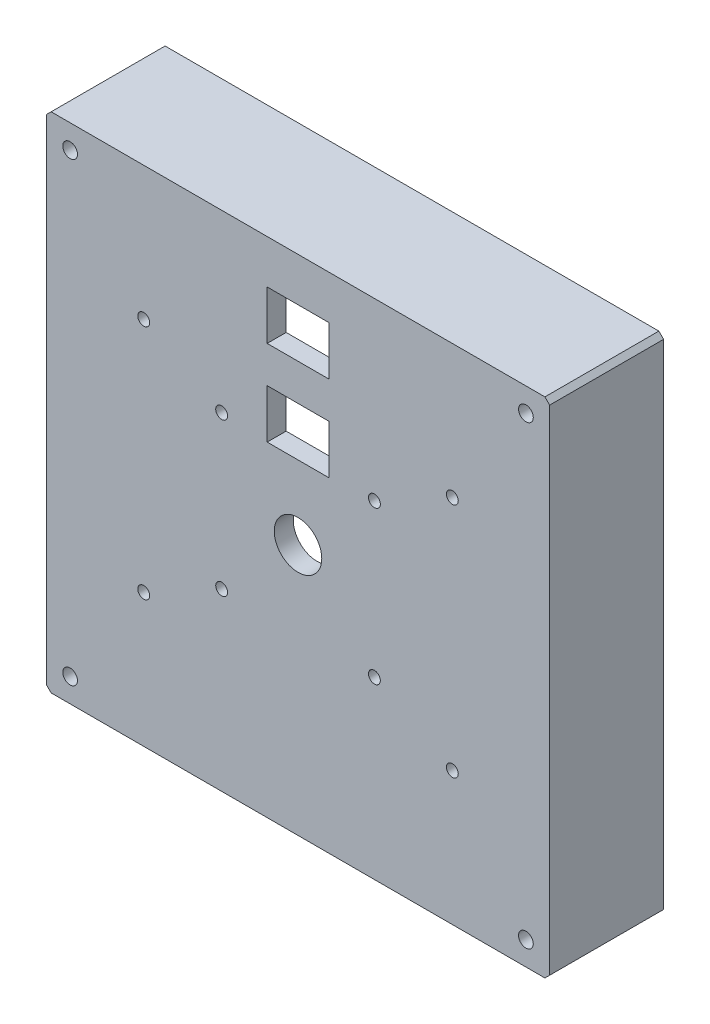
from build123d import *

# Parameters (mm, degrees)
SKETCH1_W               = 106
SKETCH1_H               = 106
BOSS_EXTRUDE1_DEPTH     = 4
SKETCH2_W               = 106
SKETCH2_H               = 106
BOSS_EXTRUDE2_DEPTH     = 20
SKETCH7_R               = 1.55
CUT_EXTRUDE2_DEPTH      = 50
SKETCH8_R               = 1.25
SKETCH8_R_2             = 5
SKETCH8_W               = 13
SKETCH8_H               = 10.3
CUT_EXTRUDE3_DEPTH      = 10
SKETCH9_R               = 4.5
BOSS_EXTRUDE3_DEPTH     = 4
SKETCH14_R              = 2.5
SKETCH14_W              = 13
SKETCH14_H              = 8
CUT_EXTRUDE4_DEPTH      = 10
CHAMFER1_SIZE           = 1
CHAMFER2_SIZE           = 1
CUT_EXTRUDE5_DEPTH      = 97
CUT_EXTRUDE5_DEPTH_BACK = 1
SKETCH15_R              = 1.6
CHAMFER3_SIZE           = 1


with BuildPart() as part:
    # Sketch1 → Boss-Extrude1 (new body)
    with BuildSketch(Plane.XY):
        Rectangle(SKETCH1_W, SKETCH1_H)
    extrude(amount=-BOSS_EXTRUDE1_DEPTH)

    # Sketch2 → Boss-Extrude2 (add)
    with BuildSketch(Plane(origin=(0, 0, -4), x_dir=(-1, 0, 0), z_dir=(0, 0, -1))):
        Rectangle(SKETCH2_W, SKETCH2_H)
        Polygon((-48, 41), (-48, -41), (-41, -48), (41, -48), (48, -41), (48, 41), (41, 48), (-41, 48), align=None, mode=Mode.SUBTRACT)
    extrude(amount=BOSS_EXTRUDE2_DEPTH)

    # Sketch7 → Cut-Extrude2 (cut)
    with BuildSketch(Plane.XY):
        with Locations((-48, 48)):
            Circle(SKETCH7_R)
        with Locations((48, 48)):
            Circle(SKETCH7_R)
        with Locations((-48, -48)):
            Circle(SKETCH7_R)
        with Locations((48, -48)):
            Circle(SKETCH7_R)
    extrude(amount=-CUT_EXTRUDE2_DEPTH, mode=Mode.SUBTRACT)

    # Sketch8 → Cut-Extrude3 (cut)
    with BuildSketch(Plane.XY):
        with Locations((32.5, 24.9)):
            Circle(SKETCH8_R)
        with Locations((-32.5, 24.9)):
            Circle(SKETCH8_R)
        with Locations((-32.5, -24.9)):
            Circle(SKETCH8_R)
        with Locations((32.5, -24.9)):
            Circle(SKETCH8_R)
        with Locations((16.086679272, -16.086679272)):
            Circle(SKETCH8_R)
        with Locations((-16.086679272, -16.086679272)):
            Circle(SKETCH8_R)
        with Locations((16.086679272, 16.086679272)):
            Circle(SKETCH8_R)
        with Locations((-16.086679272, 16.086679272)):
            Circle(SKETCH8_R)
        Circle(SKETCH8_R_2)
        with Locations((0, 38.65)):
            Rectangle(SKETCH8_W, SKETCH8_H)
        with Locations((0, 20.65)):
            Rectangle(SKETCH8_W, SKETCH8_H)
    extrude(amount=-CUT_EXTRUDE3_DEPTH, mode=Mode.SUBTRACT)

    # Sketch9 → Boss-Extrude3 (add)
    # profile 1 of 4: a face of its own
    with BuildSketch(Plane.XY.offset(-4)):
        with Locations((-34.5, 41)):
            Circle(SKETCH9_R)
        Polygon((-35.701219331, 38.1), (-33.298780669, 38.1), (-31.6, 39.798780669), (-31.6, 42.201219331), (-33.298780669, 43.9), (-35.701219331, 43.9), (-37.4, 42.201219331), (-37.4, 39.798780669), align=None, mode=Mode.SUBTRACT)
    # profile 2 of 4: a face of its own
    with BuildSketch(Plane.XY.offset(-4)):
        with Locations(Location((34.5, 41, 0), (0, 0, 180))):
            Circle(SKETCH9_R)
        Polygon((37.4, 39.798780669), (35.701219331, 38.1), (33.298780669, 38.1), (31.6, 39.798780669), (31.6, 42.201219331), (33.298780669, 43.9), (35.701219331, 43.9), (37.4, 42.201219331), align=None, mode=Mode.SUBTRACT)
    # profile 3 of 4: a face of its own
    with BuildSketch(Plane.XY.offset(-4)):
        with Locations((34.5, -41)):
            Circle(SKETCH9_R)
        Polygon((35.701219331, -38.1), (33.298780669, -38.1), (31.6, -39.798780669), (31.6, -42.201219331), (33.298780669, -43.9), (35.701219331, -43.9), (37.4, -42.201219331), (37.4, -39.798780669), align=None, mode=Mode.SUBTRACT)
    # profile 4 of 4: a face of its own
    with BuildSketch(Plane.XY.offset(-4)):
        with Locations(Location((-34.5, -41, 0), (0, 0, 180))):
            Circle(SKETCH9_R)
        Polygon((-37.4, -39.798780669), (-35.701219331, -38.1), (-33.298780669, -38.1), (-31.6, -39.798780669), (-31.6, -42.201219331), (-33.298780669, -43.9), (-35.701219331, -43.9), (-37.4, -42.201219331), align=None, mode=Mode.SUBTRACT)
    extrude(amount=-BOSS_EXTRUDE3_DEPTH)

    # Sketch14 → Cut-Extrude4 (cut)
    with BuildSketch(Plane.XZ.offset(53)):
        with Locations((20, -10.83)):
            Circle(SKETCH14_R)
        with Locations((0, -10.83)):
            Rectangle(SKETCH14_W, SKETCH14_H)
    extrude(amount=-CUT_EXTRUDE4_DEPTH, mode=Mode.SUBTRACT)

    # Chamfer1
    chamfer1_edges = [part.edges().sort_by_distance(p)[0] for p in [
        (-53, 53, -12),
        (53, 53, -12),
        (53, -53, -12),
        (-53, -53, -12),
    ]]
    chamfer(chamfer1_edges, length=CHAMFER1_SIZE)

    # Chamfer2
    chamfer2_edges = [part.edges().sort_by_distance(p)[0] for p in [
        (-6.5, -53, -10.83),
        (0, -53, -14.83),
        (6.5, -53, -10.83),
        (0, -53, -6.83),
    ]]
    chamfer(chamfer2_edges, length=CHAMFER2_SIZE)

    # Sketch15 → Cut-Extrude5 (cut, two sides: drawn at the far end of the back side and taken through both)
    with BuildSketch(Plane.ZY.offset(-48).offset(-CUT_EXTRUDE5_DEPTH_BACK)):
        with Locations(Location((-12, -23, 0), (0, 0, 90))):
            Circle(SKETCH15_R)
        with Locations(Location((-12, 23, 0), (0, 0, 90))):
            Circle(SKETCH15_R)
    extrude(amount=CUT_EXTRUDE5_DEPTH + CUT_EXTRUDE5_DEPTH_BACK, mode=Mode.SUBTRACT)

    # Chamfer3
    chamfer3_edges = [part.edges().sort_by_distance(p)[0] for p in [
        (17.5, -48, -10.83),
        (17.5, -53, -10.83),
    ]]
    chamfer(chamfer3_edges, length=CHAMFER3_SIZE)


solid = part.part
